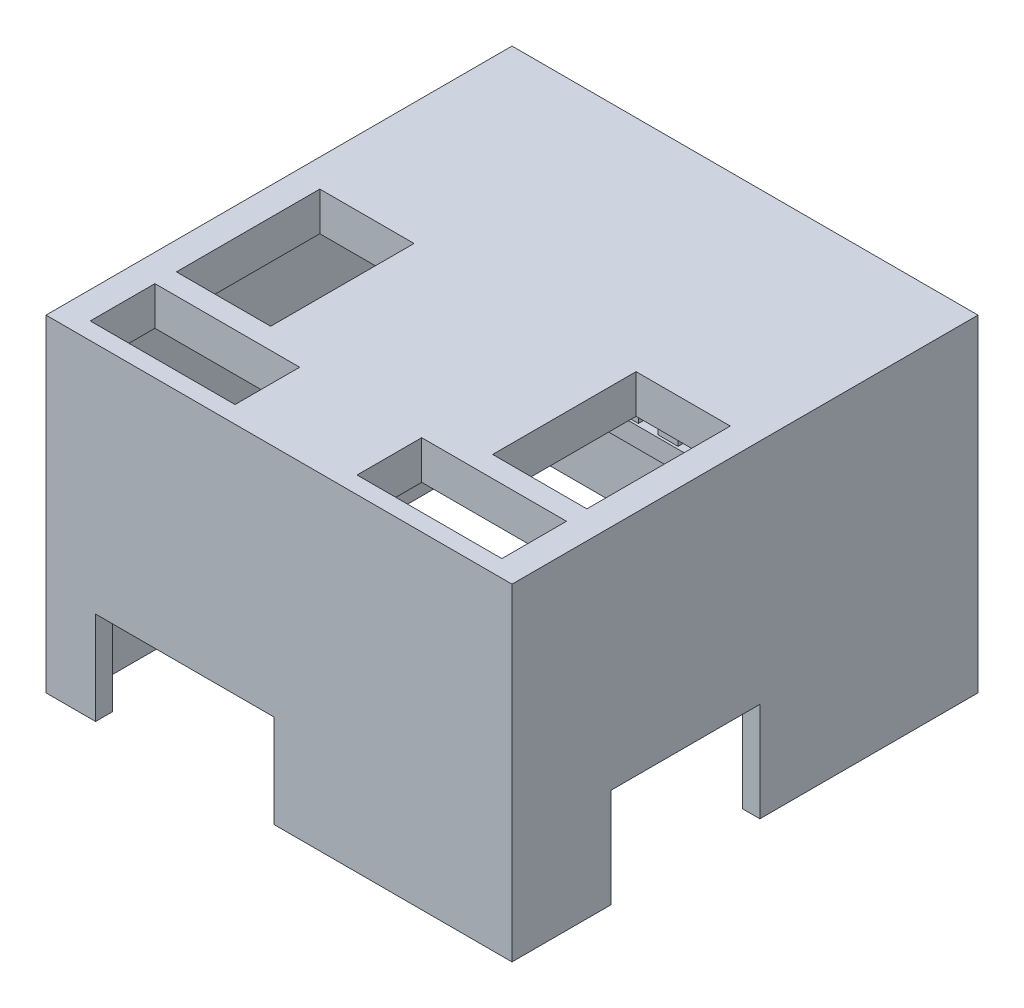
from build123d import *

# Parameters (mm, degrees)
SKETCH1_W           = 47
SKETCH1_H           = 47
BOSS_EXTRUDE1_DEPTH = 30
SKETCH2_W           = 43.5
SKETCH2_H           = 43.5
CUT_EXTRUDE1_DEPTH  = 26.1
SKETCH5_W           = 47
SKETCH5_H           = 47
BOSS_EXTRUDE3_DEPTH = 3
CUT_EXTRUDE3_REACH  = 62.508
SKETCH4_W           = 2
SKETCH4_H           = 20
LPATTERN1_COUNT     = 7
LPATTERN1_PITCH     = 4
SKETCH8_W           = 26
SKETCH8_H           = 2
BOSS_EXTRUDE4_DEPTH = 2
LPATTERN2_COUNT     = 5
LPATTERN2_PITCH     = 4
SKETCH9_W           = 18
SKETCH9_H           = 9.389923451
CUT_EXTRUDE4_DEPTH  = 10
SKETCH10_W          = 15
SKETCH10_H          = 10
CUT_EXTRUDE5_DEPTH  = 61.508263898
SKETCH11_W          = 9.504801384
SKETCH11_H          = 14.465733587
SKETCH11_W_2        = 14.602344504
SKETCH11_H_2        = 6.519720082
CUT_EXTRUDE6_DEPTH  = 47.834816109


with BuildPart() as part:
    # Sketch1 → Boss-Extrude1 (new body)
    with BuildSketch(Plane(origin=(0, 0, 0), x_dir=(1, 0, 0), z_dir=(0, 1, 0))):
        Rectangle(SKETCH1_W, SKETCH1_H)
    extrude(amount=BOSS_EXTRUDE1_DEPTH)

    # Sketch2 → Cut-Extrude1 (cut)
    with BuildSketch(Plane.XZ):
        Rectangle(SKETCH2_W, SKETCH2_H)
    extrude(amount=-CUT_EXTRUDE1_DEPTH, mode=Mode.SUBTRACT)

    # Sketch5 → Boss-Extrude3 (add)
    with BuildSketch(Plane.XZ):
        Rectangle(SKETCH5_W, SKETCH5_H)
        Polygon((-16.6, 21.75), (-21.75, 21.75), (-21.75, 16.6), (-21.75, -16.6), (-21.75, -21.75), (-16.6, -21.75), (16.6, -21.75), (21.75, -21.75), (21.75, -16.6), (21.75, 16.6), (21.75, 21.75), (16.6, 21.75), align=None, mode=Mode.SUBTRACT)
    extrude(amount=BOSS_EXTRUDE3_DEPTH)

    # Sketch4 → Cut-Extrude3 (cut, up to next)
    with BuildSketch(Plane(origin=(0, 0, -23.5), x_dir=(-1, 0, 0), z_dir=(0, 0, -1)), mode=Mode.PRIVATE) as cut_extrude3_sk1:
        with Locations((-12, 13.157296847)):
            Rectangle(SKETCH4_W, SKETCH4_H)
    cut_extrude3_tool1 = extrude(cut_extrude3_sk1.sketch, amount=-CUT_EXTRUDE3_REACH, mode=Mode.PRIVATE) & part.part
    cut_extrude3 = cut_extrude3_tool1.solids().sort_by_distance((12, 13.157297, -23.5))[0]
    add(cut_extrude3, mode=Mode.SUBTRACT)

    # LPattern1: Cut-Extrude3 ×7
    with Locations(*[(-i * LPATTERN1_PITCH, 0, 0) for i in range(1, LPATTERN1_COUNT)]):
        add(cut_extrude3, mode=Mode.SUBTRACT)

    # Sketch8 → Boss-Extrude4 (add)
    with BuildSketch(Plane(origin=(0, 0, -23.5), x_dir=(-1, 0, 0), z_dir=(0, 0, -1))):
        with Locations((0, 20.157296847)):
            Rectangle(SKETCH8_W, SKETCH8_H)
    boss_extrude4 = extrude(amount=-BOSS_EXTRUDE4_DEPTH)

    # LPattern2: Boss-Extrude4 ×5
    with Locations(*[(0, -i * LPATTERN2_PITCH, 0) for i in range(1, LPATTERN2_COUNT)]):
        add(boss_extrude4)

    # Sketch9 → Cut-Extrude4 (cut)
    with BuildSketch(Plane.XY.offset(23.5)):
        with Locations((-9.5, 1.694961726)):
            Rectangle(SKETCH9_W, SKETCH9_H)
    extrude(amount=-CUT_EXTRUDE4_DEPTH, mode=Mode.SUBTRACT)

    # Sketch10 → Cut-Extrude5 (cut, through all)
    with BuildSketch(Plane.ZY.offset(23.5)):
        with Locations((6, 2)):
            Rectangle(SKETCH10_W, SKETCH10_H)
    extrude(amount=-CUT_EXTRUDE5_DEPTH, mode=Mode.SUBTRACT)

    # Sketch11 → Cut-Extrude6 (cut, through all)
    with BuildSketch(Plane(origin=(0, 30, 0), x_dir=(1, 0, 0), z_dir=(0, 1, 0))):
        with Locations((-15.948112, -5.914939324)):
            Rectangle(SKETCH11_W, SKETCH11_H)
        with Locations((-13.45587944, -18.519566616)):
            Rectangle(SKETCH11_W_2, SKETCH11_H_2)
        with Locations((15.948112, -5.914939324)):
            Rectangle(SKETCH11_W, SKETCH11_H)
        with Locations((13.45587944, -18.519566616)):
            Rectangle(SKETCH11_W_2, SKETCH11_H_2)
    extrude(amount=-CUT_EXTRUDE6_DEPTH, mode=Mode.SUBTRACT)


solid = part.part
